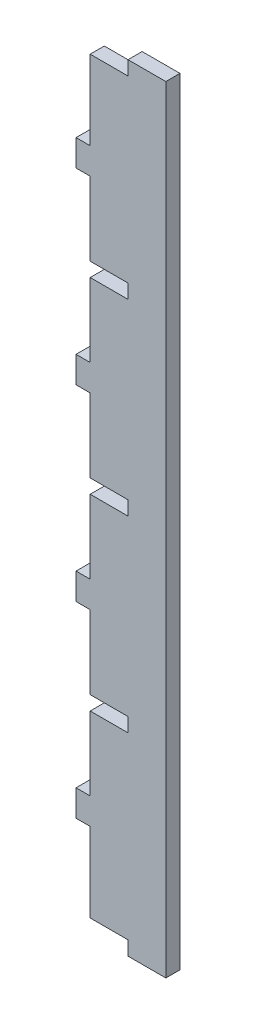
from build123d import *

# Parameters (mm, degrees)
BOSS_EXTRUDE1_DEPTH = 5.35


with BuildPart() as part:
    # Model → Boss-Extrude1 (new body)
    with BuildSketch(Plane.XY):
        Polygon((19.674999232, 5.350008607), (19.674999232, 0), (33.999999054, 0), (33.999999054, 293.999999762), (19.674999232, 293.999999762), (19.674999232, 288.650006056), (5.349999294, 288.650006056), (5.349999294, 258.618012071), (0, 258.618012071), (0, 248.618006706), (5.349999294, 248.618006706), (5.349999294, 220.753669739), (19.674999232, 220.753669739), (19.674999232, 215.403676033), (5.349999294, 215.403676033), (5.349999294, 187.539339066), (0, 187.539339066), (0, 177.539341152), (5.349999294, 177.539341152), (5.349999294, 149.675006047), (19.674999232, 149.675006047), (19.674999232, 144.325006753), (5.349999294, 144.325006753), (5.349999294, 116.46067258), (0, 116.46067258), (0, 106.460673735), (5.349999294, 106.460673735), (5.349999294, 78.59633863), (19.674999232, 78.59633863), (19.674999232, 73.246341199), (5.349999294, 73.246341199), (5.349999294, 45.382007957), (0, 45.382007957), (0, 35.382010043), (5.349999294, 35.382010043), (5.349999294, 5.350008607), align=None)
    extrude(amount=BOSS_EXTRUDE1_DEPTH)


solid = part.part
